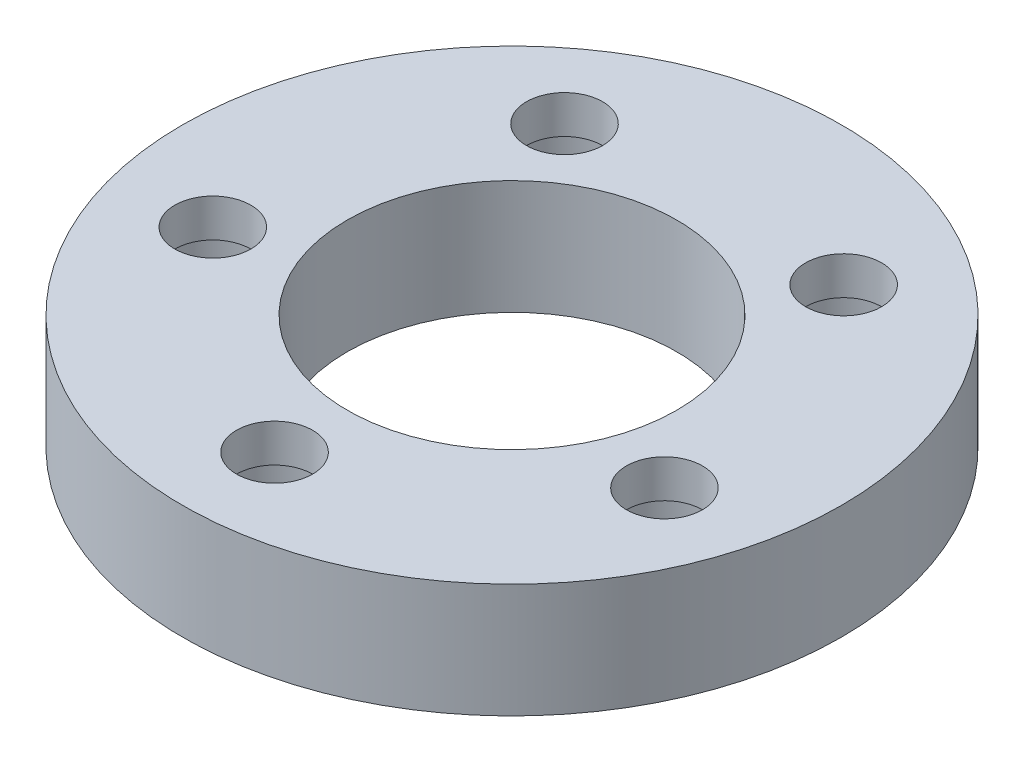
from build123d import *

# Parameters (mm, degrees)
SKETCH1_W          = 11
SKETCH1_H          = 7.62
SKETCH2_R          = 2.54
CUT_EXTRUDE1_DEPTH = 33.032240009
SKETCH3_R          = 3.96875
CUT_EXTRUDE2_DEPTH = 5.08


with BuildPart() as part:
    # Sketch1 → Revolve1 (revolve)
    with BuildSketch(Plane.XY, mode=Mode.PRIVATE) as revolve1_sk:
        with Locations((16.5, -29.147212191)):
            Rectangle(SKETCH1_W, SKETCH1_H)
    revolve(revolve1_sk.sketch.rotate(Axis((0, 18.662787809, 0), (0, -1, 0)), 180), axis=Axis((0, 18.662787809, 0), (0, -1, 0)))

    # Sketch2 → Cut-Extrude1 (cut, through all)
    with BuildSketch(Plane.XZ.offset(32.957212191)):
        with Locations((15.074245783, 4.897919361)):
            Circle(SKETCH2_R)
        with Locations((0, 15.85)):
            Circle(SKETCH2_R)
        with Locations((9.316396249, -12.822919361)):
            Circle(SKETCH2_R)
        with Locations((-9.316396249, -12.822919361)):
            Circle(SKETCH2_R)
        with Locations((-15.074245783, 4.897919361)):
            Circle(SKETCH2_R)
    extrude(amount=-CUT_EXTRUDE1_DEPTH, mode=Mode.SUBTRACT)

    # Sketch3 → Cut-Extrude2 (cut)
    with BuildSketch(Plane(origin=(0, -32.957212191, 0), x_dir=(-1, 0, 0), z_dir=(0, -1, 0))):
        with Locations(Location((0, -15.85, 0), (0, 0, 180))):
            Circle(SKETCH3_R)
        with Locations(Location((-15.074245783, -4.897919361, 0), (0, 0, 180))):
            Circle(SKETCH3_R)
        with Locations(Location((-9.316396249, 12.822919361, 0), (0, 0, 180))):
            Circle(SKETCH3_R)
        with Locations(Location((9.316396249, 12.822919361, 0), (0, 0, 180))):
            Circle(SKETCH3_R)
        with Locations(Location((15.074245783, -4.897919361, 0), (0, 0, 180))):
            Circle(SKETCH3_R)
    extrude(amount=-CUT_EXTRUDE2_DEPTH, mode=Mode.SUBTRACT)


solid = part.part
